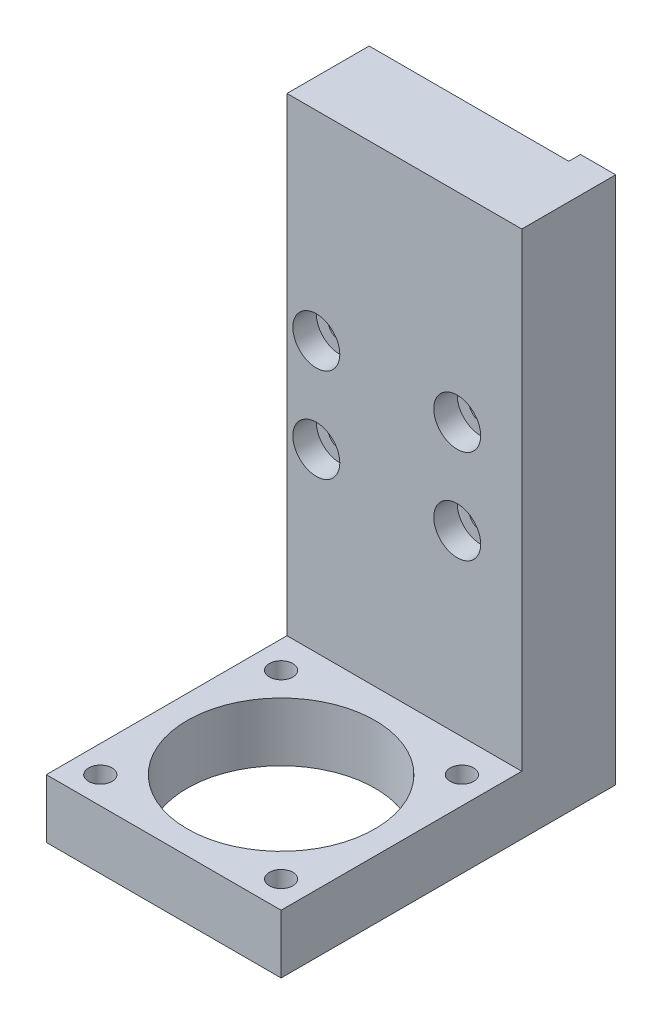
from build123d import *

# Parameters (mm, degrees)
BOSS_EXTRUDE1_DEPTH = 20
SKETCH3_R           = 8
SKETCH3_R_2         = 1
CUT_EXTRUDE1_DEPTH  = 10
SKETCH4_R           = 1
CUT_EXTRUDE2_DEPTH  = 10
SKETCH5_R           = 2
CUT_EXTRUDE3_DEPTH  = 2
SKETCH6_W           = 17
SKETCH6_H           = 1
CUT_EXTRUDE4_DEPTH  = 65


with BuildPart() as part:
    # Sketch1 → Boss-Extrude1 (new body)
    with BuildSketch(Plane(origin=(0, 0, 0), x_dir=(0, 0, -1), z_dir=(1, 0, 0))):
        Polygon((0, 0), (20.5, 0), (20.5, 40), (28.5, 40), (28.5, -5), (0, -5), align=None)
    extrude(amount=BOSS_EXTRUDE1_DEPTH)

    # Sketch3 → Cut-Extrude1 (cut)
    with BuildSketch(Plane(origin=(0, 0, 0), x_dir=(1, 0, 0), z_dir=(0, 1, 0))):
        with Locations(Location((10, 10, 0), (0, 0, 270))):
            Circle(SKETCH3_R)
        with Locations(Location((2.3, 17.7, 0), (0, 0, 270))):
            Circle(SKETCH3_R_2)
        with Locations(Location((17.7, 17.7, 0), (0, 0, 270))):
            Circle(SKETCH3_R_2)
        with Locations(Location((17.7, 2.3, 0), (0, 0, 270))):
            Circle(SKETCH3_R_2)
        with Locations(Location((2.3, 2.3, 0), (0, 0, 270))):
            Circle(SKETCH3_R_2)
    extrude(amount=-CUT_EXTRUDE1_DEPTH, mode=Mode.SUBTRACT)

    # Sketch4 → Cut-Extrude2 (cut)
    with BuildSketch(Plane.XY.offset(-20.5)):
        with Locations((2.5, 15)):
            Circle(SKETCH4_R)
        with Locations((2.5, 23)):
            Circle(SKETCH4_R)
        with Locations((14.5, 23)):
            Circle(SKETCH4_R)
        with Locations((14.5, 15)):
            Circle(SKETCH4_R)
    extrude(amount=-CUT_EXTRUDE2_DEPTH, mode=Mode.SUBTRACT)

    # Sketch5 → Cut-Extrude3 (cut)
    with BuildSketch(Plane.XY.offset(-20.5)):
        with Locations((2.5, 23)):
            Circle(SKETCH5_R)
        with Locations((2.5, 15)):
            Circle(SKETCH5_R)
        with Locations((14.5, 15)):
            Circle(SKETCH5_R)
        with Locations((14.5, 23)):
            Circle(SKETCH5_R)
    extrude(amount=-CUT_EXTRUDE3_DEPTH, mode=Mode.SUBTRACT)

    # Sketch6 → Cut-Extrude4 (cut)
    with BuildSketch(Plane(origin=(0, 40, 0), x_dir=(1, 0, 0), z_dir=(0, 1, 0))):
        with Locations((8.5, 28)):
            Rectangle(SKETCH6_W, SKETCH6_H)
    extrude(amount=-CUT_EXTRUDE4_DEPTH, mode=Mode.SUBTRACT)


solid = part.part
